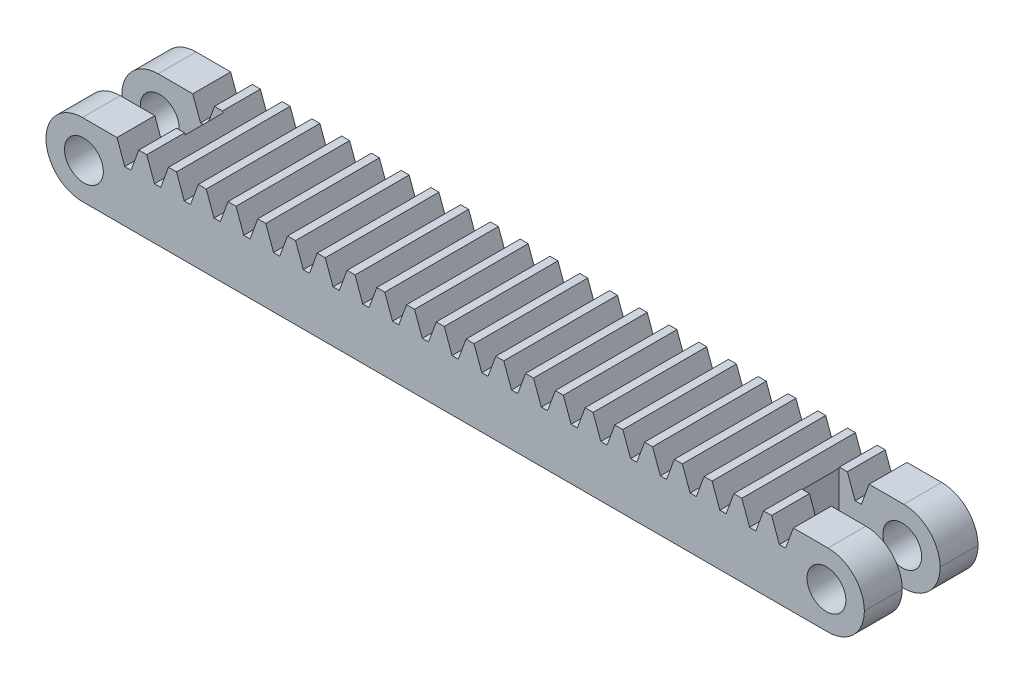
from build123d import *

# Parameters (mm, degrees)
SKETCH6_W            = 62.23
SKETCH6_H            = 2.032
BOSS_EXTRUDE2_DEPTH  = 3.175
BOSS_EXTRUDE3_DEPTH  = 3.175
LPATTERN2_COUNT      = 24
LPATTERN2_PITCH      = 2.493518
SKETCH9_W            = 2.910078
SKETCH9_H            = 2.032
CUT_EXTRUDE1_DEPTH   = 3.175
SKETCH10_W           = 59.319922
SKETCH10_H           = 6.35
BOSS_EXTRUDE4_DEPTH  = 0.508
SKETCH11_W           = 68.58
SKETCH11_H           = 2.54
BOSS_EXTRUDE5_DEPTH  = 6.35
SKETCH12_W           = 6.35
SKETCH12_H           = 6.35
BOSS_EXTRUDE6_DEPTH  = 1.778
SKETCH14_W           = 31.115
SKETCH14_H           = 1.778
BOSS_EXTRUDE7_DEPTH  = 6.35
CUT_EXTRUDE2_REACH   = 66.378
SKETCH13_R           = 1.627
FILLET1_R            = 3.048
FILLET1_OF_MIRROR4_R = 3.048
CUT_EXTRUDE3_REACH   = 66.319
SKETCH16_W           = 5.94905084
SKETCH16_H           = 3.175
CUT_EXTRUDE4_REACH   = 66.241
SKETCH18_W           = 74.285931649
SKETCH18_H           = 23.332469726
SKETCH19_W           = 3.175
SKETCH19_H           = 6.1039375
CUT_EXTRUDE5_DEPTH   = 2.54
SKETCH20_W           = 3.175
SKETCH20_H           = 6.1039375
CUT_EXTRUDE6_DEPTH   = 2.54


with BuildPart() as part:
    # Sketch6 → Boss-Extrude2 (new, symmetric)
    with BuildSketch(Plane.XY):
        with Locations((31.115, 1.016)):
            Rectangle(SKETCH6_W, SKETCH6_H)
    extrude(amount=BOSS_EXTRUDE2_DEPTH, both=True)

    # Sketch7 → Boss-Extrude3 (add, symmetric)
    with BuildSketch(Plane.XY):
        Polygon((1.31901184, 3.8179375), (1.969008, 2.032), (0, 2.032), (0.64999616, 3.8179375), align=None)
    boss_extrude3 = extrude(amount=BOSS_EXTRUDE3_DEPTH, both=True)

    # LPattern2: Boss-Extrude3 ×24
    with Locations(*[(i * LPATTERN2_PITCH, 0, 0) for i in range(1, LPATTERN2_COUNT)]):
        add(boss_extrude3)

    # Sketch9 → Cut-Extrude1 (cut, symmetric)
    with BuildSketch(Plane.XY):
        with Locations((60.774961, 1.016)):
            Rectangle(SKETCH9_W, SKETCH9_H)
    extrude(amount=CUT_EXTRUDE1_DEPTH, both=True, mode=Mode.SUBTRACT)

    # Sketch10 → Boss-Extrude4 (add)
    with BuildSketch(Plane.XZ):
        with Locations((29.659961, 0)):
            Rectangle(SKETCH10_W, SKETCH10_H)
    extrude(amount=BOSS_EXTRUDE4_DEPTH)

    # Sketch11 → Boss-Extrude5 (add)
    with BuildSketch(Plane.XY.offset(3.175)):
        with Locations((29.659961, 0.762)):
            Rectangle(SKETCH11_W, SKETCH11_H)
    extrude(amount=-BOSS_EXTRUDE5_DEPTH)

    # Sketch12 → Boss-Extrude6 (add)
    with BuildSketch(Plane.XZ.offset(0.508)):
        with Locations((-1.455039, 0)):
            Rectangle(SKETCH12_W, SKETCH12_H)
    boss_extrude6 = extrude(amount=BOSS_EXTRUDE6_DEPTH)

    # Sketch14 → Boss-Extrude7 (add)
    with BuildSketch(Plane.XY.offset(3.175)):
        Polygon((-4.630039, 2.92496875), (-4.630039, 2.032), (0, 2.032), (0.32499808, 2.92496875), (0.64999616, 3.8179375), (-4.630039, 3.8179375), align=None)
        with Locations((17.277461, -1.397)):
            Rectangle(SKETCH14_W, SKETCH14_H)
    boss_extrude7 = extrude(amount=-BOSS_EXTRUDE7_DEPTH)

    # Sketch13 → Cut-Extrude2 (cut, up to next)
    with BuildSketch(Plane.XY.offset(3.175), mode=Mode.PRIVATE) as cut_extrude2_sk1:
        with Locations((-1.455039, 0.762)):
            Circle(SKETCH13_R)
    cut_extrude2_tool1 = extrude(cut_extrude2_sk1.sketch, amount=-CUT_EXTRUDE2_REACH, mode=Mode.PRIVATE) & part.part
    cut_extrude2 = cut_extrude2_tool1.solids().sort_by_distance((-1.455039, 0.762, 3.175))[0]
    add(cut_extrude2, mode=Mode.SUBTRACT)

    # Fillet1
    fillet1_edges = [part.edges().sort_by_distance(p)[0] for p in [
        (-4.630039, -2.286, 0),
        (-4.630039, 3.8179375, 0),
    ]]
    fillet(fillet1_edges, radius=FILLET1_R)

    # Mirror4: Boss-Extrude6, Boss-Extrude7, Cut-Extrude2 across plane
    add(boss_extrude6.mirror(Plane.ZY.offset(-29.659961)))
    add(boss_extrude7.mirror(Plane.ZY.offset(-29.659961)))
    add(cut_extrude2.mirror(Plane.ZY.offset(-29.659961)), mode=Mode.SUBTRACT)

    # Fillet1 of Mirror4
    fillet1_of_mirror4_edges = [part.edges().sort_by_distance(p)[0] for p in [
        (63.949961, -2.286, 0),
        (63.949961, 3.8179375, 0),
    ]]
    fillet(fillet1_of_mirror4_edges, radius=FILLET1_OF_MIRROR4_R)

    # Sketch16 → Cut-Extrude3 (cut, up to next)
    with BuildSketch(Plane(origin=(0, 3.8179375, 0), x_dir=(1, 0, 0), z_dir=(0, 1, 0)), mode=Mode.PRIVATE) as cut_extrude3_sk1:
        with Locations((-1.65551358, -1.5875)):
            Rectangle(SKETCH16_W, SKETCH16_H)
    cut_extrude3_tool1 = extrude(cut_extrude3_sk1.sketch, amount=-CUT_EXTRUDE3_REACH, mode=Mode.PRIVATE) & part.part
    # Sketch16 → Cut-Extrude3 (cut, up to next)
    with BuildSketch(Plane(origin=(0, 3.8179375, 0), x_dir=(1, 0, 0), z_dir=(0, 1, 0)), mode=Mode.PRIVATE) as cut_extrude3_sk2:
        with Locations((60.97543558, -1.5875)):
            Rectangle(SKETCH16_W, SKETCH16_H)
    cut_extrude3_tool2 = extrude(cut_extrude3_sk2.sketch, amount=-CUT_EXTRUDE3_REACH, mode=Mode.PRIVATE) & part.part
    add(cut_extrude3_tool1.solids().sort_by_distance((-1.655514, 3.817937, 1.5875))[0], mode=Mode.SUBTRACT)
    add(cut_extrude3_tool2.solids().sort_by_distance((60.975436, 3.817937, 1.5875))[0], mode=Mode.SUBTRACT)

    # Sketch18 → Cut-Extrude4 (cut, up to next)
    with BuildSketch(Plane.XY.offset(1.5875), mode=Mode.PRIVATE) as cut_extrude4_sk1:
        with Locations((31.985939291, 1.965301306)):
            Rectangle(SKETCH18_W, SKETCH18_H)
    cut_extrude4_tool1 = extrude(cut_extrude4_sk1.sketch, amount=CUT_EXTRUDE4_REACH, mode=Mode.PRIVATE) & part.part
    add(cut_extrude4_tool1.solids().sort_by_distance((31.985939, 1.965301, 1.5875))[0], mode=Mode.SUBTRACT)

    # Mirror11: part across plane


with BuildPart() as part_1:
    add(part.part)
    add(part.part.mirror(Plane.XY.offset(1.5875)))

    # Sketch19 → Cut-Extrude5 (cut)
    with BuildSketch(Plane(origin=(58.00091016, 0, 0), x_dir=(0, 0, -1), z_dir=(1, 0, 0))):
        with Locations((-1.5875, 0.76596875)):
            Rectangle(SKETCH19_W, SKETCH19_H)
    extrude(amount=-CUT_EXTRUDE5_DEPTH, mode=Mode.SUBTRACT)

    # Sketch20 → Cut-Extrude6 (cut)
    with BuildSketch(Plane.ZY.offset(-1.31901184)):
        with Locations((1.5875, 0.76596875)):
            Rectangle(SKETCH20_W, SKETCH20_H)
    extrude(amount=-CUT_EXTRUDE6_DEPTH, mode=Mode.SUBTRACT)


solid = part_1.part
